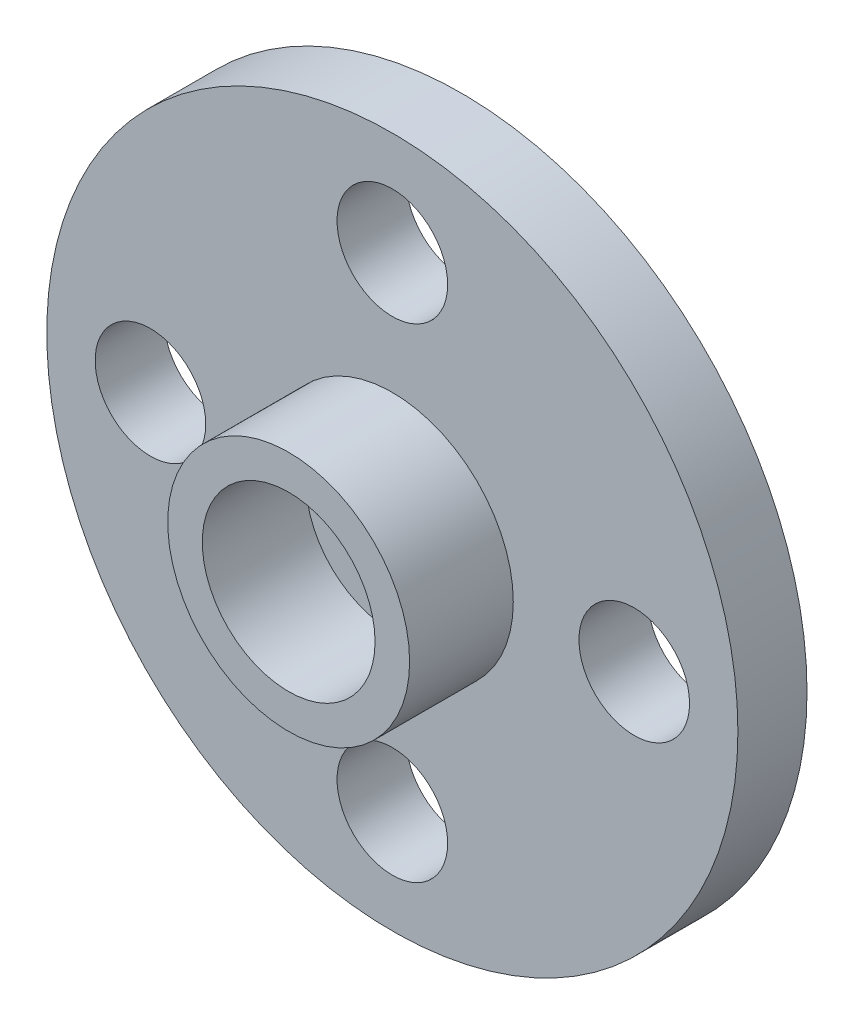
from build123d import *

# Parameters (mm, degrees)
SKETCH_1_R      = 10
SKETCH_1_R_2    = 1.6
EXTRUDE_1_DEPTH = 2
SKETCH_2_R      = 3.5
SKETCH_2_R_2    = 2.5
EXTRUDE_2_DEPTH = 3


with BuildPart() as part:
    # ｽｹｯﾁ1 → ﾎﾞｽ - 押し出し1 (new body)
    with BuildSketch(Plane.XY):
        Circle(SKETCH_1_R)
        with Locations((0, 7)):
            Circle(SKETCH_1_R_2, mode=Mode.SUBTRACT)
        with Locations((7, 0)):
            Circle(SKETCH_1_R_2, mode=Mode.SUBTRACT)
        with Locations((-7, 0)):
            Circle(SKETCH_1_R_2, mode=Mode.SUBTRACT)
        with Locations((0, -7)):
            Circle(SKETCH_1_R_2, mode=Mode.SUBTRACT)
    extrude(amount=EXTRUDE_1_DEPTH)

    # ｽｹｯﾁ2 → ﾎﾞｽ - 押し出し2 (add)
    with BuildSketch(Plane.XY.offset(2)):
        Circle(SKETCH_2_R)
        Circle(SKETCH_2_R_2, mode=Mode.SUBTRACT)
    extrude(amount=EXTRUDE_2_DEPTH)


solid = part.part
